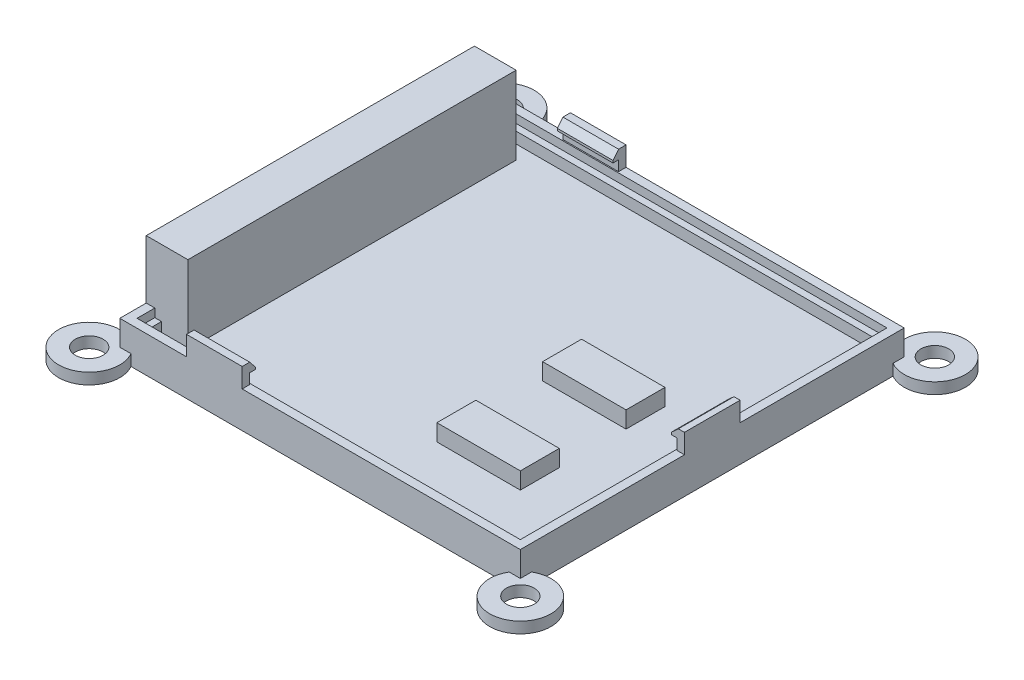
from build123d import *

# Parameters (mm, degrees)
SKETCH2_W           = 66.5
SKETCH2_H           = 63.5
BOSS_EXTRUDE1_DEPTH = 3
SKETCH6_W           = 72
SKETCH6_H           = 69
SKETCH6_W_2         = 66.5
SKETCH6_H_2         = 63.5
BOSS_EXTRUDE2_DEPTH = 5
SKETCH14_W          = 7.5
SKETCH14_H          = 59
BOSS_EXTRUDE4_DEPTH = 14
BOSS_EXTRUDE5_DEPTH = 1.5
SKETCH16_R          = 5.5
SKETCH16_R_2        = 2.5
BOSS_EXTRUDE6_DEPTH = 2
BOSS_EXTRUDE7_DEPTH = 10
BOSS_EXTRUDE8_DEPTH = 5
SKETCH19_W          = 15
SKETCH19_H          = 7
BOSS_EXTRUDE9_DEPTH = 3


with BuildPart() as part:
    # Sketch2 → Boss-Extrude1 (new body)
    with BuildSketch(Plane(origin=(0, 0, 0), x_dir=(1, 0, 0), z_dir=(0, 1, 0))):
        Rectangle(SKETCH2_W, SKETCH2_H)
    extrude(amount=BOSS_EXTRUDE1_DEPTH)

    # Sketch6 → Boss-Extrude2 (add)
    with BuildSketch(Plane(origin=(0, 0, 0), x_dir=(1, 0, 0), z_dir=(0, 1, 0))):
        Rectangle(SKETCH6_W, SKETCH6_H)
        Rectangle(SKETCH6_W_2, SKETCH6_H_2, mode=Mode.SUBTRACT)
    extrude(amount=BOSS_EXTRUDE2_DEPTH)

    # Sketch14 → Boss-Extrude4 (add)
    with BuildSketch(Plane(origin=(0, 3, 0), x_dir=(1, 0, 0), z_dir=(0, 1, 0))):
        with Locations((-32.25, -0.25)):
            Rectangle(SKETCH14_W, SKETCH14_H)
    extrude(amount=BOSS_EXTRUDE4_DEPTH)

    # Sketch15 → Boss-Extrude5 (add)
    with BuildSketch(Plane(origin=(0, 5, 0), x_dir=(1, 0, 0), z_dir=(0, 1, 0))):
        Polygon((-34.45, 32.95), (34.45, 32.95), (34.45, -32.95), (-34.45, -32.95), (-34.45, -29.75), (-36, -29.75), (-36, -34.5), (36, -34.5), (36, 34.5), (-36, 34.5), (-36, 29.25), (-34.45, 29.25), align=None)
    extrude(amount=BOSS_EXTRUDE5_DEPTH)

    # Sketch16 → Boss-Extrude6 (add)
    # profile 1 of 4: a face of its own
    with BuildSketch(Plane.XZ):
        with Locations((-38.75, 37.25)):
            Circle(SKETCH16_R)
        with Locations(Location((-38.75, 37.25, 0), (0, 0, 270))):
            Circle(SKETCH16_R_2, mode=Mode.SUBTRACT)
    # profile 2 of 4: a face of its own
    with BuildSketch(Plane.XZ):
        with Locations((38.75, 37.25)):
            Circle(SKETCH16_R)
        with Locations(Location((38.75, 37.25, 0), (0, 0, 270))):
            Circle(SKETCH16_R_2, mode=Mode.SUBTRACT)
    # profile 3 of 4: a face of its own
    with BuildSketch(Plane.XZ):
        with Locations((38.75, -37.25)):
            Circle(SKETCH16_R)
        with Locations(Location((38.75, -37.25, 0), (0, 0, 270))):
            Circle(SKETCH16_R_2, mode=Mode.SUBTRACT)
    # profile 4 of 4: a face of its own
    with BuildSketch(Plane.XZ):
        with Locations((-38.75, -37.25)):
            Circle(SKETCH16_R)
        with Locations(Location((-38.75, -37.25, 0), (0, 0, 270))):
            Circle(SKETCH16_R_2, mode=Mode.SUBTRACT)
    extrude(amount=-BOSS_EXTRUDE6_DEPTH)

    # Sketch17 → Boss-Extrude7 (add)
    with BuildSketch(Plane.ZY.offset(24)):
        Polygon((34.5, 6.5), (33.15, 6.5), (33.15, 8.35), (32.15, 8.35), (32.15, 8.75), (33.15, 10), (34.5, 10), align=None)
    boss_extrude7 = extrude(amount=-BOSS_EXTRUDE7_DEPTH)

    # Mirror1: Boss-Extrude7 across plane
    add(boss_extrude7.mirror(Plane.XY))

    # Sketch18 → Boss-Extrude8 (add, symmetric)
    with BuildSketch(Plane.XY):
        Polygon((36, 6.5), (34.65, 6.5), (34.65, 8.45), (33.65, 8.45), (33.65, 8.85), (34.90023603, 10), (36, 10), align=None)
    extrude(amount=BOSS_EXTRUDE8_DEPTH, both=True)

    # Sketch19 → Boss-Extrude9 (add)
    with BuildSketch(Plane(origin=(0, 3, 0), x_dir=(1, 0, 0), z_dir=(0, 1, 0))):
        with Locations((15.75, -18.25)):
            Rectangle(SKETCH19_W, SKETCH19_H)
        with Locations((15.75, 0.75)):
            Rectangle(SKETCH19_W, SKETCH19_H)
    extrude(amount=BOSS_EXTRUDE9_DEPTH)


solid = part.part
